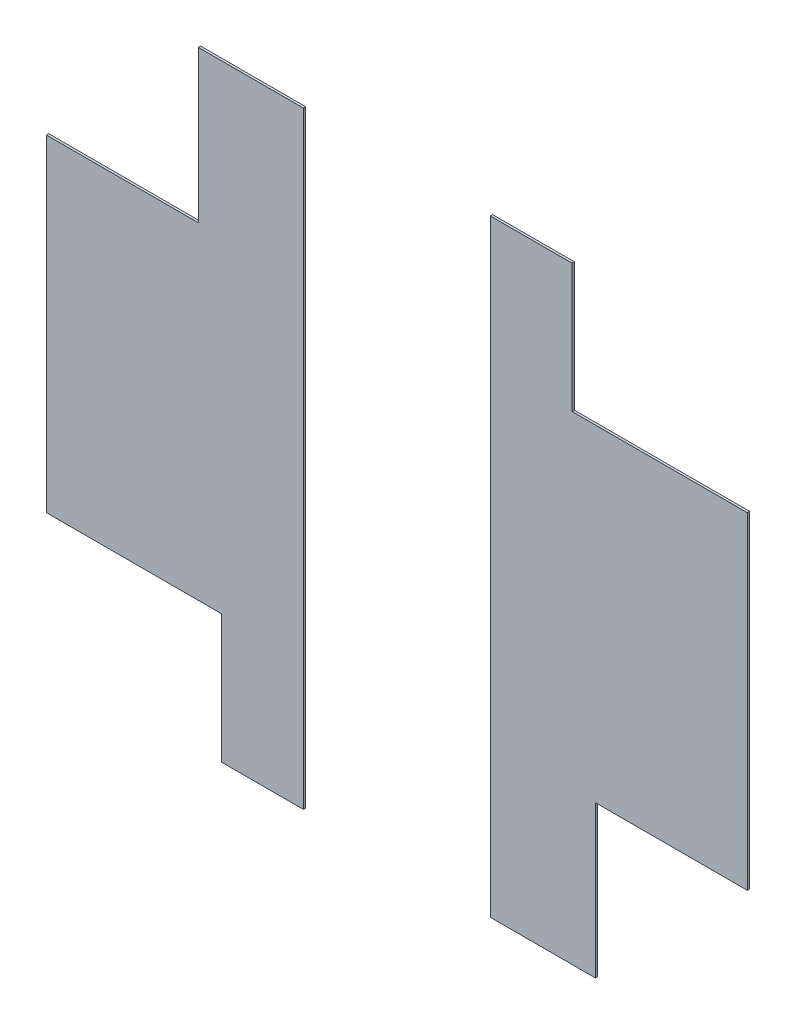
from build123d import *

# Parameters (mm, degrees)
SKETCH1_W           = 762
SKETCH1_H           = 660.4
BOSS_EXTRUDE1_DEPTH = 2.54
SKETCH2_W           = 165.1
SKETCH2_H           = 165.1
SKETCH2_W_2         = 190.5
SKETCH2_H_2         = 139.7
CUT_EXTRUDE1_DEPTH  = 1009.354407736
SKETCH3_W           = 203.2
SKETCH3_H           = 660.4
CUT_EXTRUDE2_DEPTH  = 1009.354407736


with BuildPart() as part:
    # Sketch1 → Boss-Extrude1 (new body)
    with BuildSketch(Plane.XY):
        with Locations((-381, 330.2)):
            Rectangle(SKETCH1_W, SKETCH1_H)
    extrude(amount=BOSS_EXTRUDE1_DEPTH)

    # Sketch2 → Cut-Extrude1 (cut, through all)
    with BuildSketch(Plane.XY.offset(2.54)):
        with Locations((-679.45, 577.85)):
            Rectangle(SKETCH2_W, SKETCH2_H)
        with Locations((-95.25, 590.55)):
            Rectangle(SKETCH2_W_2, SKETCH2_H_2)
        with Locations((-82.55, 82.55)):
            Rectangle(SKETCH2_W, SKETCH2_H)
        with Locations((-666.75, 69.85)):
            Rectangle(SKETCH2_W_2, SKETCH2_H_2)
    extrude(amount=-CUT_EXTRUDE1_DEPTH, mode=Mode.SUBTRACT)

    # Sketch3 → Cut-Extrude2 (cut, through all)
    with BuildSketch(Plane.XY.offset(2.54)):
        with Locations((-381, 330.2)):
            Rectangle(SKETCH3_W, SKETCH3_H)
    extrude(amount=-CUT_EXTRUDE2_DEPTH, mode=Mode.SUBTRACT)


with BuildPart() as cut_extrude2_piece_1:
    # of the separate pieces the step leaves, piece 1, a body of its own (cut_extrude2_pieces)
    add(part.part.solids().sort_by_distance((-482.6, 0, 0))[0])


with BuildPart() as cut_extrude2_piece_2:
    # of the separate pieces the step leaves, piece 2, a body of its own (cut_extrude2_pieces)
    add(part.part.solids().sort_by_distance((-165.1, 0, 0))[0])


solid = Compound([cut_extrude2_piece_1.part, cut_extrude2_piece_2.part])
